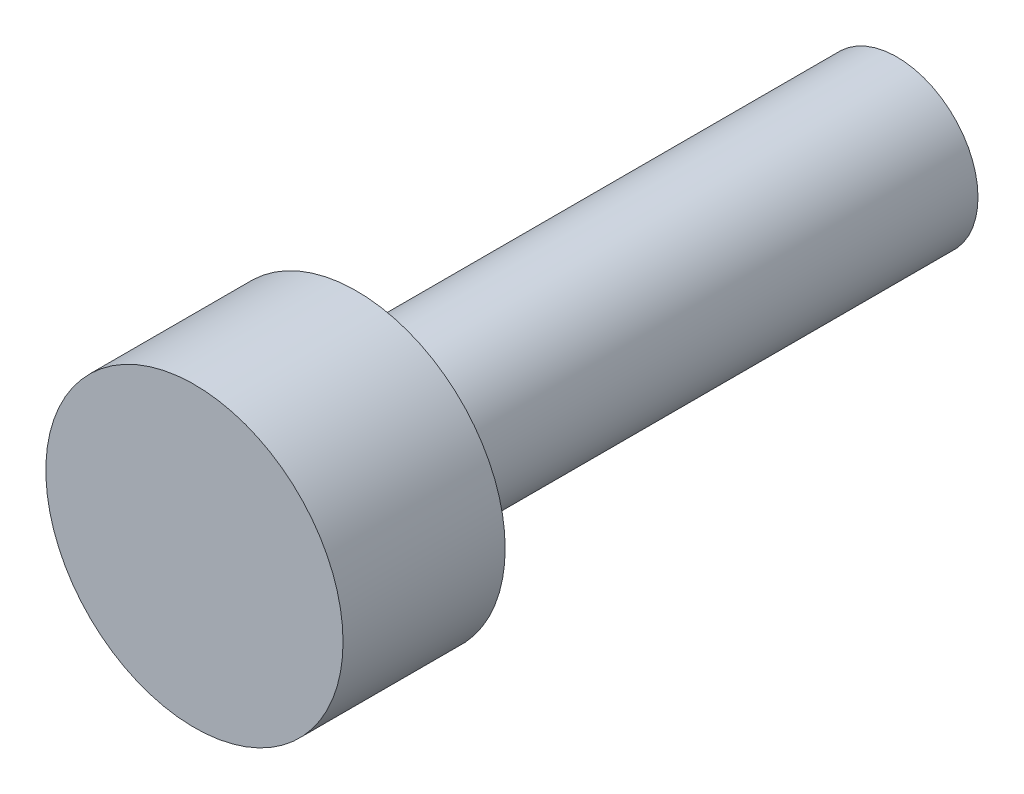
from build123d import *

# Parameters (mm, degrees)
SKETCH1_R           = 1.5
BOSS_EXTRUDE1_DEPTH = 10
SKETCH2_R           = 2.75
BOSS_EXTRUDE2_DEPTH = 3


with BuildPart() as part:
    # Sketch1 → Boss-Extrude1 (new body)
    with BuildSketch(Plane.XY):
        Circle(SKETCH1_R)
    extrude(amount=BOSS_EXTRUDE1_DEPTH)

    # Sketch2 → Boss-Extrude2 (add)
    with BuildSketch(Plane.XY.offset(10)):
        Circle(SKETCH2_R)
    extrude(amount=BOSS_EXTRUDE2_DEPTH)


solid = part.part
